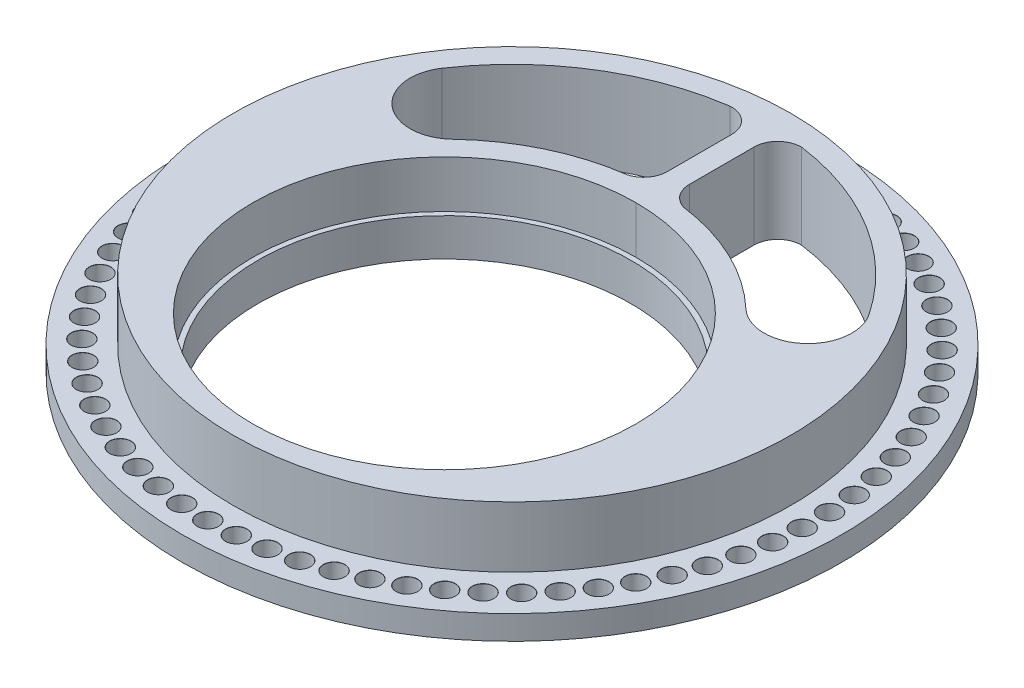
from build123d import *

# Parameters (mm, degrees)
SKETCH1_R                       = 61.9125
SKETCH1_R_2                     = 35.052
BOSS_EXTRUDE1_DEPTH             = 4.5212
SKETCH3_R                       = 52.3875
BOSS_EXTRUDE2_DEPTH             = 11.43
SKETCH4_R                       = 35.052
CUT_EXTRUDE1_DEPTH              = 89.998629731
SKETCH9_R                       = 36.000000009
CUT_EXTRUDE3_DEPTH              = 8.89
F_4_0MM_DOWEL_HOLE1_D           = 4
F_4_0MM_DOWEL_HOLE1_CSINK_D     = 4.05
F_4_0MM_DOWEL_HOLE1_CSINK_ANGLE = 90
CIRPATTERN1_COUNT               = 70
CUT_EXTRUDE5_DEPTH              = 89.998629731
BOSS_EXTRUDE3_REACH             = 89.92
BOSS_EXTRUDE3_DIRECTION_2_REACH = 89.92


with BuildPart() as part:
    # Sketch1 → Boss-Extrude1 (new body)
    with BuildSketch(Plane(origin=(0, 0, 0), x_dir=(1, 0, 0), z_dir=(0, 1, 0))):
        with Locations(Location((0, 0, 0), (0, 0, 270))):
            Circle(SKETCH1_R)
        with Locations(Location((0, -12.7, 0), (0, 0, 270))):
            Circle(SKETCH1_R_2, mode=Mode.SUBTRACT)
    extrude(amount=BOSS_EXTRUDE1_DEPTH)

    # Sketch3 → Boss-Extrude2 (add)
    with BuildSketch(Plane(origin=(0, 4.5212, 0), x_dir=(1, 0, 0), z_dir=(0, 1, 0))):
        with Locations(Location((0, 0, 0), (0, 0, 270))):
            Circle(SKETCH3_R)
    extrude(amount=BOSS_EXTRUDE2_DEPTH)

    # Sketch4 → Cut-Extrude1 (cut, through all)
    with BuildSketch(Plane.XZ):
        with Locations(Location((0, 12.7, 0), (0, 0, 270))):
            Circle(SKETCH4_R)
    extrude(amount=-CUT_EXTRUDE1_DEPTH, mode=Mode.SUBTRACT)

    # Sketch9 → Cut-Extrude3 (cut)
    with BuildSketch(Plane(origin=(0, 15.9512, 0), x_dir=(1, 0, 0), z_dir=(0, 1, 0))):
        with Locations(Location((0, -12.7, 0), (0, 0, 270))):
            Circle(SKETCH9_R)
    extrude(amount=-CUT_EXTRUDE3_DEPTH, mode=Mode.SUBTRACT)

    # Ø4.0mm Dowel Hole1 (through all)
    with Locations(Plane(origin=(0, 4.5212, 0), x_dir=(1, 0, 0), z_dir=(0, 1, 0))):
        with Locations((0, 57.15)):
            f_4_0mm_dowel_hole1 = CounterSinkHole(F_4_0MM_DOWEL_HOLE1_D / 2, F_4_0MM_DOWEL_HOLE1_CSINK_D / 2, counter_sink_angle=F_4_0MM_DOWEL_HOLE1_CSINK_ANGLE)

    # CirPattern1: Ø4.0mm Dowel Hole1 ×70 about axis
    cirpattern1_axis = Axis((0, 0, 0), (0, 1, 0))
    for i in range(1, CIRPATTERN1_COUNT):
        add(f_4_0mm_dowel_hole1.rotate(cirpattern1_axis, i * 360 / CIRPATTERN1_COUNT), mode=Mode.SUBTRACT)

    # Sketch10 → Cut-Extrude5 (cut, through all)
    with BuildSketch(Plane(origin=(0, 15.9512, 0), x_dir=(1, 0, 0), z_dir=(0, 1, 0))):
        with BuildLine():
            ThreePointArc((-27.568698422, 16.370448294), (0, 27.364000009), (27.568698422, 16.370448294))
            ThreePointArc((27.568698422, 16.370448294), (38.57955057, 16.056999754), (40.099152196, 26.966991775))
            ThreePointArc((40.099152196, 26.966991775), (0, 48.3235), (-40.099152196, 26.966991775))
            ThreePointArc((-40.099152196, 26.966991775), (-38.57955057, 16.056999754), (-27.568698422, 16.370448294))
        make_face()
    extrude(amount=-CUT_EXTRUDE5_DEPTH, mode=Mode.SUBTRACT)

    # Boss-Extrude3: up to this face of the body (flat: up to its plane)
    boss_extrude3_end = Plane(part.part.faces().sort_by_distance((0, 15.9512, -50.90575774))[0])
    # Sketch15 → Boss-Extrude3 (add, up to the picked face)
    with BuildSketch(Plane(origin=(0, 7.9756, 0), x_dir=(1, 0, 0), z_dir=(0, 1, 0)), mode=Mode.PRIVATE) as boss_extrude3_sk1:
        with BuildLine():
            ThreePointArc((2.032, 31.29096677), (2.926793499, 28.616259533), (5.250924096, 27.018407481))
            ThreePointArc((5.250924096, 27.018407481), (-0.056014781, 27.363960851), (-5.361966653, 27.003569239))
            ThreePointArc((-5.361966653, 27.003569239), (-3.020045747, 28.598028587), (-2.11713302, 31.283478782))
            Line((-2.11713302, 31.283478782), (-2.11713302, 43.39578959))
            ThreePointArc((-2.11713302, 43.39578959), (-3.543125847, 46.658245825), (-6.906163701, 47.827456081))
            ThreePointArc((-6.906163701, 47.827456081), (-0.203176512, 48.32307287), (6.503741299, 47.883838624))
            ThreePointArc((6.503741299, 47.883838624), (3.343379097, 46.591449005), (2.032, 43.438919063))
            Line((2.032, 43.438919063), (2.032, 31.29096677))
        make_face()
    boss_extrude3_tool1 = split(extrude(boss_extrude3_sk1.sketch, amount=BOSS_EXTRUDE3_REACH, mode=Mode.PRIVATE), bisect_by=boss_extrude3_end, keep=Keep.BOTH, mode=Mode.PRIVATE)
    add(boss_extrude3_tool1.solids().sort_by(Axis((-0.049426, 7.9756, -38.213586), (0, 1, 0)))[0])

    # Boss-Extrude3 direction 2: up to this face of the body (flat: up to its plane)
    boss_extrude3_direction_2_end = Plane(part.part.faces().sort_by_distance((0, 0, -60.161350056))[0])
    # Sketch15 → Boss-Extrude3 direction 2 (add, up to the picked face)
    with BuildSketch(Plane(origin=(0, 7.9756, 0), x_dir=(1, 0, 0), z_dir=(0, 1, 0)), mode=Mode.PRIVATE) as boss_extrude3_direction_2_sk1:
        with BuildLine():
            ThreePointArc((2.032, 31.29096677), (2.926793499, 28.616259533), (5.250924096, 27.018407481))
            ThreePointArc((5.250924096, 27.018407481), (-0.056014781, 27.363960851), (-5.361966653, 27.003569239))
            ThreePointArc((-5.361966653, 27.003569239), (-3.020045747, 28.598028587), (-2.11713302, 31.283478782))
            Line((-2.11713302, 31.283478782), (-2.11713302, 43.39578959))
            ThreePointArc((-2.11713302, 43.39578959), (-3.543125847, 46.658245825), (-6.906163701, 47.827456081))
            ThreePointArc((-6.906163701, 47.827456081), (-0.203176512, 48.32307287), (6.503741299, 47.883838624))
            ThreePointArc((6.503741299, 47.883838624), (3.343379097, 46.591449005), (2.032, 43.438919063))
            Line((2.032, 43.438919063), (2.032, 31.29096677))
        make_face()
    boss_extrude3_direction_2_tool1 = split(extrude(boss_extrude3_direction_2_sk1.sketch, amount=-BOSS_EXTRUDE3_DIRECTION_2_REACH, mode=Mode.PRIVATE), bisect_by=boss_extrude3_direction_2_end, keep=Keep.BOTH, mode=Mode.PRIVATE)
    add(boss_extrude3_direction_2_tool1.solids().sort_by(Axis((-0.049426, 7.9756, -38.213586), (0, -1, 0)))[0])


solid = part.part
